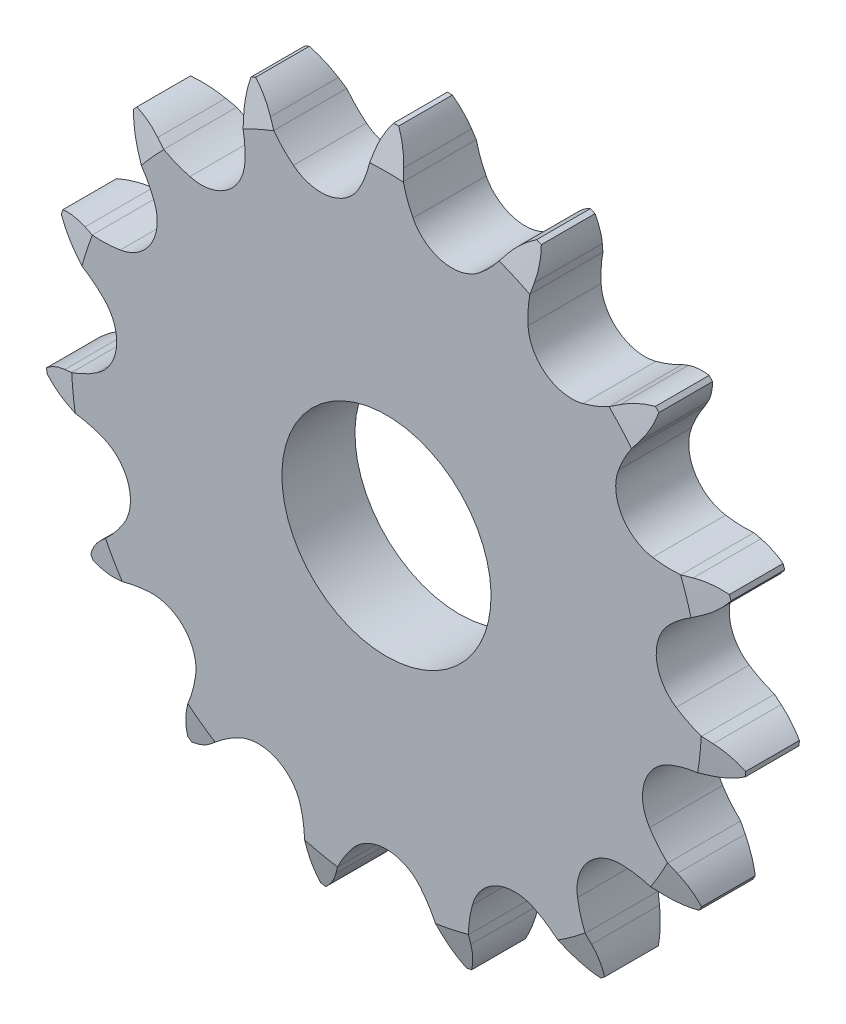
from build123d import *

# Parameters (mm, degrees)
SKETCH3_W          = 5.31
SKETCH3_H          = 17.927
CUT_EXTRUDE4_DEPTH = 37.19812817
CIRPATTERN2_COUNT  = 15
SKETCH5_OUTSIDE_W  = 346.374
SKETCH5_OUTSIDE_H  = 346.096
SKETCH5_OUTSIDE_R  = 22.906359817
CUT_EXTRUDE5_DEPTH = 37.404331097
CUT_EXTRUDE5_DRAFT = -75
SKETCH6_OUTSIDE_W  = 346.374
SKETCH6_OUTSIDE_H  = 346.096
SKETCH6_OUTSIDE_R  = 22.906359817
CUT_EXTRUDE6_DEPTH = 37.404331252
CUT_EXTRUDE6_DRAFT = -75


with BuildPart() as part:
    # Sketch3 → Revolve5 (revolve)
    with BuildSketch(Plane(origin=(0, 0, 0), x_dir=(0, 0, -1), z_dir=(1, 0, 0)), mode=Mode.PRIVATE) as revolve5_sk:
        with Locations((0, 16.5635)):
            Rectangle(SKETCH3_W, SKETCH3_H)
    revolve(revolve5_sk.sketch.rotate(Axis((0, 0, 2.655), (0, 0, -1)), 180), axis=Axis((0, 0, 2.655), (0, 0, -1)))

    # Sketch4 → Cut-Extrude4 (cut, symmetric)
    with BuildSketch(Plane.XY):
        with BuildLine():
            Line((1.219884983, 22.88872777), (1.063923116, 23.578912677))
            ThreePointArc((1.063923116, 23.578912677), (0.65856297, 24.734033373), (0, 25.765980797))
            ThreePointArc((0, 25.765980797), (5.974327611, 28.107001564), (10.479968535, 23.538394719))
            ThreePointArc((10.479968535, 23.538394719), (9.458610494, 22.863525529), (8.61846566, 21.973145089))
            Line((8.61846566, 21.973145089), (8.195263912, 21.406065208))
            ThreePointArc((8.195263912, 21.406065208), (7.524676999, 20.626400483), (6.762535268, 19.935963031))
            ThreePointArc((6.762535268, 19.935963031), (4.101738454, 19.297162233), (1.930803303, 20.962979364))
            ThreePointArc((1.930803303, 20.962979364), (1.515378398, 21.903716331), (1.219884983, 22.88872777))
        make_face()
    cut_extrude4 = extrude(amount=CUT_EXTRUDE4_DEPTH, both=True, mode=Mode.SUBTRACT)

    # CirPattern2: Cut-Extrude4 ×15 about axis
    cirpattern2_axis = Axis((0, 0, 0), (0, 0, 1))
    for i in range(1, CIRPATTERN2_COUNT):
        add(cut_extrude4.rotate(cirpattern2_axis, i * 360 / CIRPATTERN2_COUNT), mode=Mode.SUBTRACT)


with BuildPart() as cut_extrude5_tool:
    # Sketch5 outside → Cut-Extrude5 (with draft: the straight prism first)
    with BuildSketch(Plane.XY.offset(2.655)):
        with Locations((0, 0.26)):
            Rectangle(SKETCH5_OUTSIDE_W, SKETCH5_OUTSIDE_H)
        Circle(SKETCH5_OUTSIDE_R, mode=Mode.SUBTRACT)
    extrude(amount=-CUT_EXTRUDE5_DEPTH)
    # Cut-Extrude5: the draft: its side faces are tilted about the plane it starts from
    cut_extrude5_sides = [cut_extrude5_tool.faces().sort_by_distance(p)[0] for p in [
        (0, -172.788, -16.047165549),
        (173.187, 0.26, -16.047165549),
        (0, 173.308, -16.047165549),
        (-173.187, 0.26, -16.047165549),
        (-22.906359817, 0, -16.047165549),
    ]]
    draft(cut_extrude5_sides, Plane.XY.offset(2.655), CUT_EXTRUDE5_DRAFT)


with BuildPart() as part_1:
    add(part.part)

    # Cut-Extrude5: cut by cut_extrude5_tool
    add(cut_extrude5_tool.part, mode=Mode.SUBTRACT)


with BuildPart() as cut_extrude6_tool:
    # Sketch6 outside → Cut-Extrude6 (with draft: the straight prism first)
    with BuildSketch(Plane(origin=(0, 0, -2.655), x_dir=(-1, 0, 0), z_dir=(0, 0, -1))):
        with Locations((0, 0.26)):
            Rectangle(SKETCH6_OUTSIDE_W, SKETCH6_OUTSIDE_H)
        Circle(SKETCH6_OUTSIDE_R, mode=Mode.SUBTRACT)
    extrude(amount=-CUT_EXTRUDE6_DEPTH)
    # Cut-Extrude6: the draft: its side faces are tilted about the plane it starts from
    cut_extrude6_sides = [cut_extrude6_tool.faces().sort_by_distance(p)[0] for p in [
        (0, -172.788, 16.047165626),
        (-173.187, 0.26, 16.047165626),
        (0, 173.308, 16.047165626),
        (173.187, 0.26, 16.047165626),
        (22.906359817, 0, 16.047165626),
    ]]
    draft(cut_extrude6_sides, Plane(origin=(0, 0, -2.655), x_dir=(-1, 0, 0), z_dir=(0, 0, -1)), CUT_EXTRUDE6_DRAFT)


with BuildPart() as part_2:
    add(part_1.part)

    # Cut-Extrude6: cut by cut_extrude6_tool
    add(cut_extrude6_tool.part, mode=Mode.SUBTRACT)


solid = part_2.part
